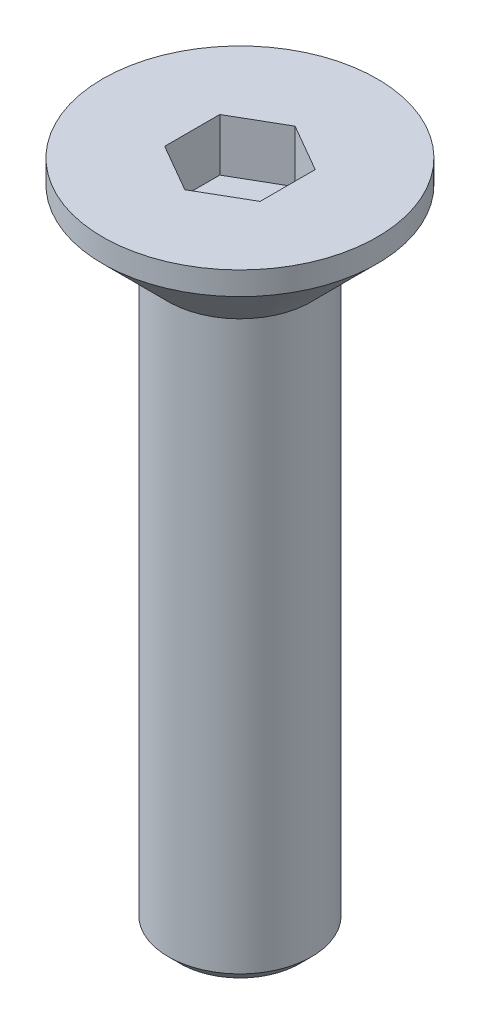
from build123d import *

# Parameters (mm, degrees)
CUT_EXTRUDE1_DEPTH = 1.1


with BuildPart() as part:
    # Sketch1 → Revolve1 (revolve)
    with BuildSketch(Plane.XY):
        Polygon((0, 0), (0, -14), (-1.25, -14), (-1.5, -13.75), (-1.5, -1.86), (-2.875, -0.485), (-2.875, 0), align=None)
    revolve(axis=Axis((0, 0, 0), (0, -1, 0)))

    # Sketch2 → Cut-Extrude1 (cut)
    with BuildSketch(Plane(origin=(0, 0, 0), x_dir=(1, 0, 0), z_dir=(0, 1, 0))):
        Polygon((-1, 0.577350269), (-1, -0.577350269), (0, -1.154700538), (1, -0.577350269), (1, 0.577350269), (0, 1.154700538), align=None)
    extrude(amount=-CUT_EXTRUDE1_DEPTH, mode=Mode.SUBTRACT)


solid = part.part
